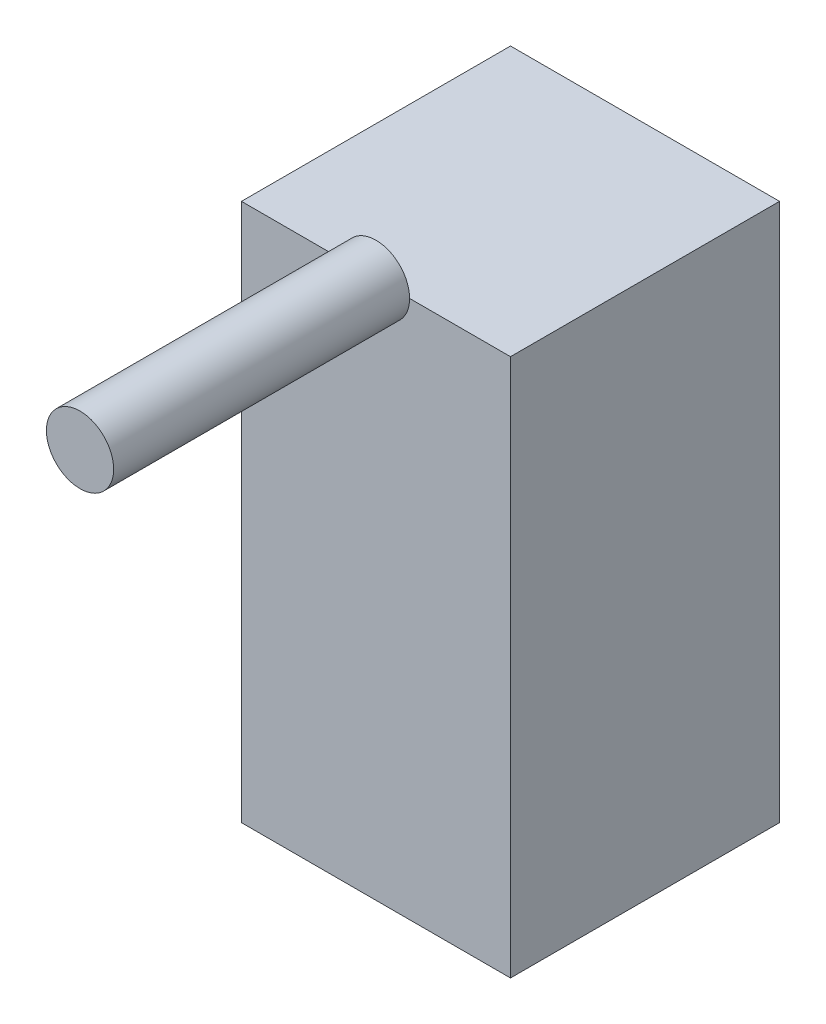
from build123d import *

# Parameters (mm, degrees)
SKETCH1_W           = 20
SKETCH1_H           = 20
BOSS_EXTRUDE1_DEPTH = 40
SKETCH5_R           = 2.5
BOSS_EXTRUDE4_DEPTH = 22


with BuildPart() as part:
    # Sketch1 → Boss-Extrude1 (new body)
    with BuildSketch(Plane(origin=(0, 0, 0), x_dir=(1, 0, 0), z_dir=(0, 1, 0))):
        Rectangle(SKETCH1_W, SKETCH1_H)
    extrude(amount=BOSS_EXTRUDE1_DEPTH)

    # Sketch5 → Boss-Extrude4 (add)
    with BuildSketch(Plane.XY.offset(10)):
        with Locations((0, 40)):
            Circle(SKETCH5_R)
    extrude(amount=BOSS_EXTRUDE4_DEPTH)


solid = part.part
